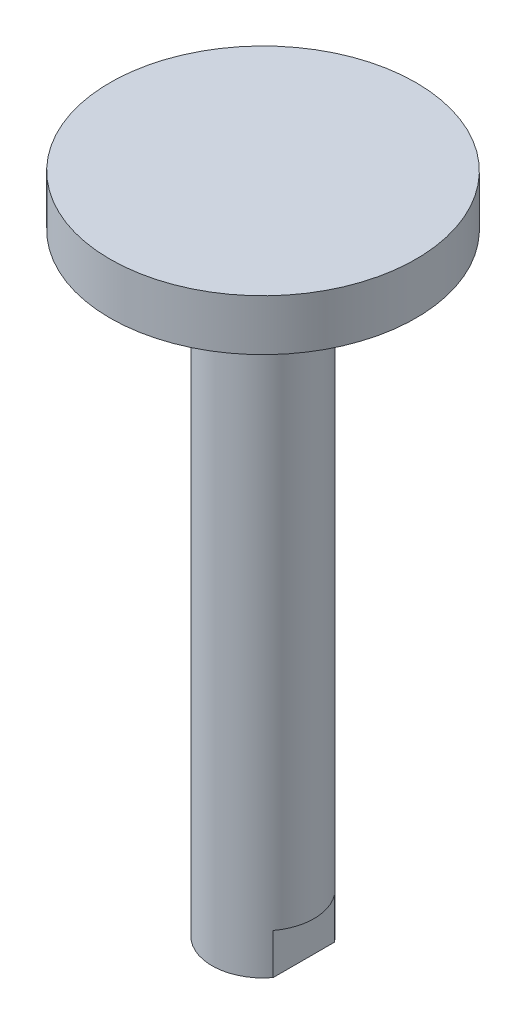
from build123d import *

# Parameters (mm, degrees)
BROCA_DE_ROSQUEAR_PARA_TARRAXA_DE_M51_D     = 4.2
BROCA_DE_ROSQUEAR_PARA_TARRAXA_DE_M51_DEPTH = 10
BROCA_DE_ROSQUEAR_PARA_TARRAXA_DE_M51_TIP   = 1.2618073
CORTE_EXTRUS_O1_DEPTH                       = 69.373971656
CORTE_EXTRUS_O1_DEPTH_BACK                  = 69.373971656
ESBO_O8_W                                   = 1
ESBO_O8_H                                   = 4


with BuildPart() as part:
    # Esboço1 → Revolução1 (revolve)
    with BuildSketch(Plane.XY, mode=Mode.PRIVATE) as revolu_o1_sk:
        Polygon((0, 0), (-5, 0), (-5, 60), (-15, 60), (-15, 65), (0, 65), align=None)
    revolve(revolu_o1_sk.sketch.rotate(Axis((0, 0, 0), (0, 1, 0)), 270), axis=Axis((0, 0, 0), (0, 1, 0)))

    # Broca de rosquear para tarraxa de M51
    with Locations(Plane(origin=(0, 0, 0), x_dir=(-1, 0, 0), z_dir=(0, -1, 0))):
        with Locations((0, 0)):
            Hole(BROCA_DE_ROSQUEAR_PARA_TARRAXA_DE_M51_D / 2, depth=BROCA_DE_ROSQUEAR_PARA_TARRAXA_DE_M51_DEPTH)
            with Locations((0, 0, -(BROCA_DE_ROSQUEAR_PARA_TARRAXA_DE_M51_DEPTH + BROCA_DE_ROSQUEAR_PARA_TARRAXA_DE_M51_TIP / 2))):  # 118° drill point
                Cone(0, BROCA_DE_ROSQUEAR_PARA_TARRAXA_DE_M51_D / 2, BROCA_DE_ROSQUEAR_PARA_TARRAXA_DE_M51_TIP, mode=Mode.SUBTRACT)

    # Esboço8 → Corte-extrusão1 (cut, two sides: drawn at the far end of the back side and taken through both)
    with BuildSketch(Plane.XY.offset(-CORTE_EXTRUS_O1_DEPTH_BACK)):
        with Locations((4.5, 2)):
            Rectangle(ESBO_O8_W, ESBO_O8_H)
        with Locations((-4.5, 2)):
            Rectangle(ESBO_O8_W, ESBO_O8_H)
    extrude(amount=CORTE_EXTRUS_O1_DEPTH + CORTE_EXTRUS_O1_DEPTH_BACK, mode=Mode.SUBTRACT)


solid = part.part
